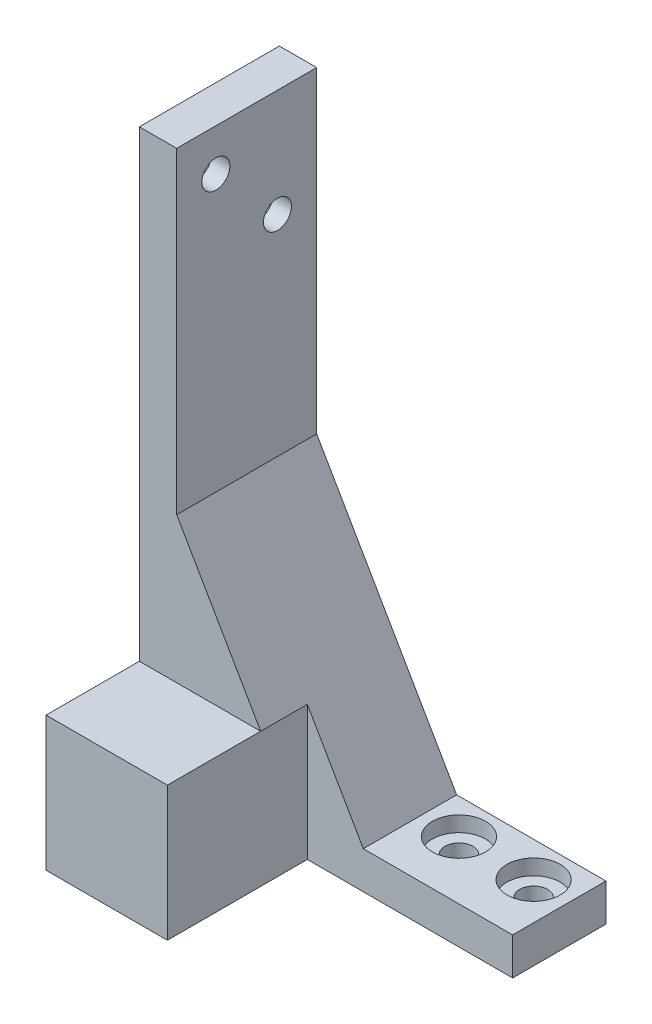
from build123d import *

# Parameters (mm, degrees)
CROQUIS1_W              = 35
CROQUIS1_H              = 15
CROQUIS1_R              = 1.5
SALIENTE_EXTRUIR1_DEPTH = 4
CROQUIS2_W              = 4
CROQUIS2_H              = 15
SALIENTE_EXTRUIR2_DEPTH = 60
SALIENTE_EXTRUIR3_DEPTH = 15
CROQUIS4_R              = 2.85
CORTAR_EXTRUIR1_DEPTH   = 1.65
CROQUIS5_W              = 5
CROQUIS5_H              = 22
CORTAR_EXTRUIR2_DEPTH   = 22
CORTAR_EXTRUIR5_REACH   = 73.507
CROQUIS6_R              = 1.5
CROQUIS7_R              = 2.5
CORTAR_EXTRUIR6_DEPTH   = 2
CROQUIS9_W              = 13
CROQUIS9_H              = 14.4
SALIENTE_EXTRUIR4_DEPTH = 10


with BuildPart() as part:
    # Croquis1 → Saliente-Extruir1 (new body)
    with BuildSketch(Plane(origin=(0, 0, 0), x_dir=(1, 0, 0), z_dir=(0, 1, 0))):
        Rectangle(CROQUIS1_W, CROQUIS1_H)
        with Locations(Location((5.5, 3.75, 0), (0, 0, 270))):
            Circle(CROQUIS1_R, mode=Mode.SUBTRACT)
        with Locations(Location((13.5, 3.75, 0), (0, 0, 270))):
            Circle(CROQUIS1_R, mode=Mode.SUBTRACT)
    extrude(amount=SALIENTE_EXTRUIR1_DEPTH)

    # Croquis2 → Saliente-Extruir2 (add)
    with BuildSketch(Plane(origin=(0, 4, 0), x_dir=(1, 0, 0), z_dir=(0, 1, 0))):
        with Locations((-15.5, 0)):
            Rectangle(CROQUIS2_W, CROQUIS2_H)
    extrude(amount=SALIENTE_EXTRUIR2_DEPTH)

    # Croquis3 → Saliente-Extruir3 (add)
    with BuildSketch(Plane.XY.offset(7.5)):
        Polygon((-13.5, 4), (-13.5, 30), (1.5, 4), align=None)
    extrude(amount=-SALIENTE_EXTRUIR3_DEPTH)

    # Croquis4 → Cortar-Extruir1 (cut)
    with BuildSketch(Plane(origin=(0, 4, 0), x_dir=(1, 0, 0), z_dir=(0, 1, 0))):
        with Locations(Location((5.5, 3.75, 0), (0, 0, 270))):
            Circle(CROQUIS4_R)
        with Locations(Location((13.5, 3.75, 0), (0, 0, 270))):
            Circle(CROQUIS4_R)
    extrude(amount=-CORTAR_EXTRUIR1_DEPTH, mode=Mode.SUBTRACT)

    # Croquis5 → Cortar-Extruir2 (cut)
    with BuildSketch(Plane(origin=(17.5, 0, 0), x_dir=(0, 0, -1), z_dir=(1, 0, 0))):
        with Locations((-5, 11)):
            Rectangle(CROQUIS5_W, CROQUIS5_H)
    extrude(amount=-CORTAR_EXTRUIR2_DEPTH, mode=Mode.SUBTRACT)

    # Croquis6 → Cortar-Extruir5 (cut, up to next)
    with BuildSketch(Plane(origin=(-13.5, 0, 0), x_dir=(0, 0, -1), z_dir=(1, 0, 0)), mode=Mode.PRIVATE) as cortar_extruir5_sk1:
        with Locations((-3.3, 59.52)):
            Circle(CROQUIS6_R)
    cortar_extruir5_tool1 = extrude(cortar_extruir5_sk1.sketch, amount=-CORTAR_EXTRUIR5_REACH, mode=Mode.PRIVATE) & part.part
    # Croquis6 → Cortar-Extruir5 (cut, up to next)
    with BuildSketch(Plane(origin=(-13.5, 0, 0), x_dir=(0, 0, -1), z_dir=(1, 0, 0)), mode=Mode.PRIVATE) as cortar_extruir5_sk2:
        with Locations((3.3, 52.48)):
            Circle(CROQUIS6_R)
    cortar_extruir5_tool2 = extrude(cortar_extruir5_sk2.sketch, amount=-CORTAR_EXTRUIR5_REACH, mode=Mode.PRIVATE) & part.part
    add(cortar_extruir5_tool1.solids().sort_by_distance((-13.5, 59.52, 3.3))[0], mode=Mode.SUBTRACT)
    add(cortar_extruir5_tool2.solids().sort_by_distance((-13.5, 52.48, -3.3))[0], mode=Mode.SUBTRACT)

    # Croquis7 → Cortar-Extruir6 (cut)
    with BuildSketch(Plane.ZY.offset(17.5)):
        with Locations((-3.3, 52.48)):
            Circle(CROQUIS7_R)
        with Locations((3.3, 59.52)):
            Circle(CROQUIS7_R)
    extrude(amount=-CORTAR_EXTRUIR6_DEPTH, mode=Mode.SUBTRACT)

    # Croquis9 → Saliente-Extruir4 (add)
    with BuildSketch(Plane.XY.offset(7.5)):
        with Locations((-11, 7.2)):
            Rectangle(CROQUIS9_W, CROQUIS9_H)
    extrude(amount=SALIENTE_EXTRUIR4_DEPTH)


solid = part.part
